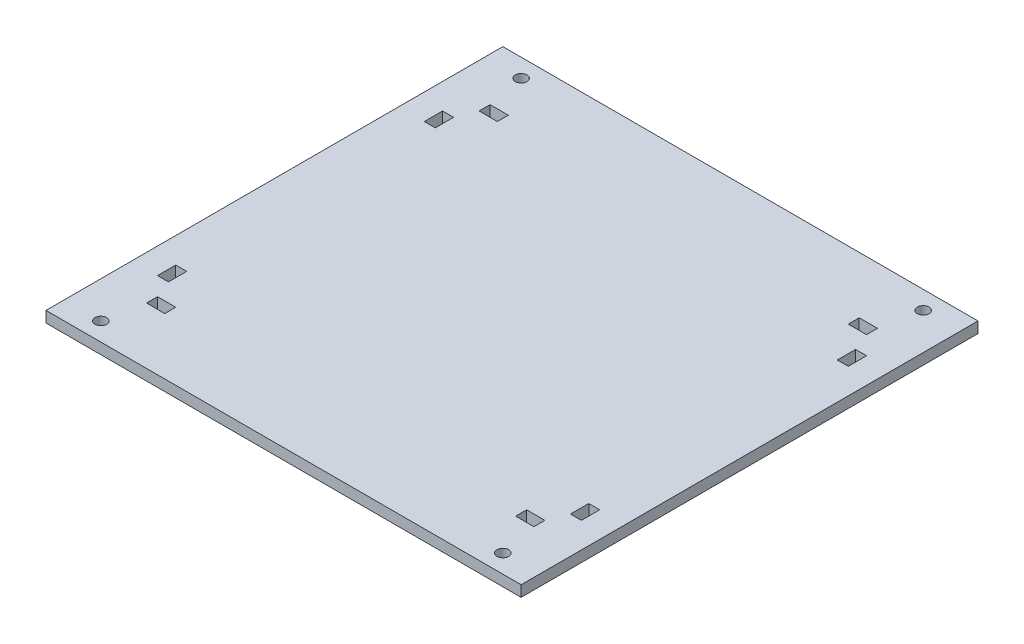
from build123d import *

# Parameters (mm, degrees)
SKETCH_2_W                 = 130
SKETCH_2_H                 = 108
EXTRUDE_1_DEPTH            = 3
SKETCH_3_W                 = 5
SKETCH_3_H                 = 3
SKETCH_3_W_2               = 3
SKETCH_3_H_2               = 5
CUT_EXTRUDE_1_DEPTH        = 155.961285488
MIRROR_2_COPY_1_SKETCH_W   = 5
MIRROR_2_COPY_1_SKETCH_H   = 3
MIRROR_2_COPY_1_SKETCH_W_2 = 3
MIRROR_2_COPY_1_SKETCH_H_2 = 5
MIRROR_2_COPY_1_DEPTH      = 155.961285488
SKETCH_5_W                 = 130
SKETCH_5_H                 = 8.5
EXTRUDE_2_DEPTH            = 3
SKETCH_6_R                 = 1.6
CUT_EXTRUDE_2_DEPTH        = 161.471960168


with BuildPart() as part:
    # 草图2 → 凸台-拉伸1 (new body)
    with BuildSketch(Plane(origin=(0, 0, 0), x_dir=(1, 0, 0), z_dir=(0, 1, 0))):
        with Locations((55, 44)):
            Rectangle(SKETCH_2_W, SKETCH_2_H)
    extrude(amount=EXTRUDE_1_DEPTH)

    # 草图3 → 切除-拉伸1 (cut, through all)
    with BuildSketch(Plane(origin=(0, 3, 0), x_dir=(1, 0, 0), z_dir=(0, 1, 0))):
        with Locations((4.5, 89.5)):
            Rectangle(SKETCH_3_W, SKETCH_3_H)
        with Locations((-1.5, 80.5)):
            Rectangle(SKETCH_3_W_2, SKETCH_3_H_2)
    cut_extrude_1 = extrude(amount=-CUT_EXTRUDE_1_DEPTH, mode=Mode.SUBTRACT)

    # 镜向1: 切除-拉伸1 across plane
    add(cut_extrude_1.mirror(Plane.ZY.offset(-55)), mode=Mode.SUBTRACT)

    # 镜向2: 切除-拉伸1 across plane
    add(cut_extrude_1.mirror(Plane(origin=(0, 0, -44), x_dir=(1, 0, 0), z_dir=(0, 0, -1))), mode=Mode.SUBTRACT)

    # 镜向2 copy 1 sketch → 镜向2 copy 1 (cut, through all)
    with BuildSketch(Plane(origin=(110, 3, -88), x_dir=(-1, 0, 0), z_dir=(0, 1, 0))):
        with Locations((4.5, 89.5)):
            Rectangle(MIRROR_2_COPY_1_SKETCH_W, MIRROR_2_COPY_1_SKETCH_H)
        with Locations((-1.5, 80.5)):
            Rectangle(MIRROR_2_COPY_1_SKETCH_W_2, MIRROR_2_COPY_1_SKETCH_H_2)
    extrude(amount=-MIRROR_2_COPY_1_DEPTH, mode=Mode.SUBTRACT)

    # 草图5 → 凸台-拉伸2 (add)
    with BuildSketch(Plane(origin=(0, 3, 0), x_dir=(1, 0, 0), z_dir=(0, 1, 0))):
        with Locations((55, 102.25)):
            Rectangle(SKETCH_5_W, SKETCH_5_H)
        with Locations((55, -14.25)):
            Rectangle(SKETCH_5_W, SKETCH_5_H)
    extrude(amount=-EXTRUDE_2_DEPTH)

    # 草图6 → 切除-拉伸2 (cut, through all)
    with BuildSketch(Plane(origin=(0, 3, 0), x_dir=(1, 0, 0), z_dir=(0, 1, 0))):
        with Locations(Location((0, 101.5, 0), (0, 0, 270))):
            Circle(SKETCH_6_R)
        with Locations(Location((0, -13.5, 0), (0, 0, 270))):
            Circle(SKETCH_6_R)
        with Locations(Location((110, 101.5, 0), (0, 0, 270))):
            Circle(SKETCH_6_R)
        with Locations(Location((110, -13.5, 0), (0, 0, 270))):
            Circle(SKETCH_6_R)
    extrude(amount=-CUT_EXTRUDE_2_DEPTH, mode=Mode.SUBTRACT)


solid = part.part
